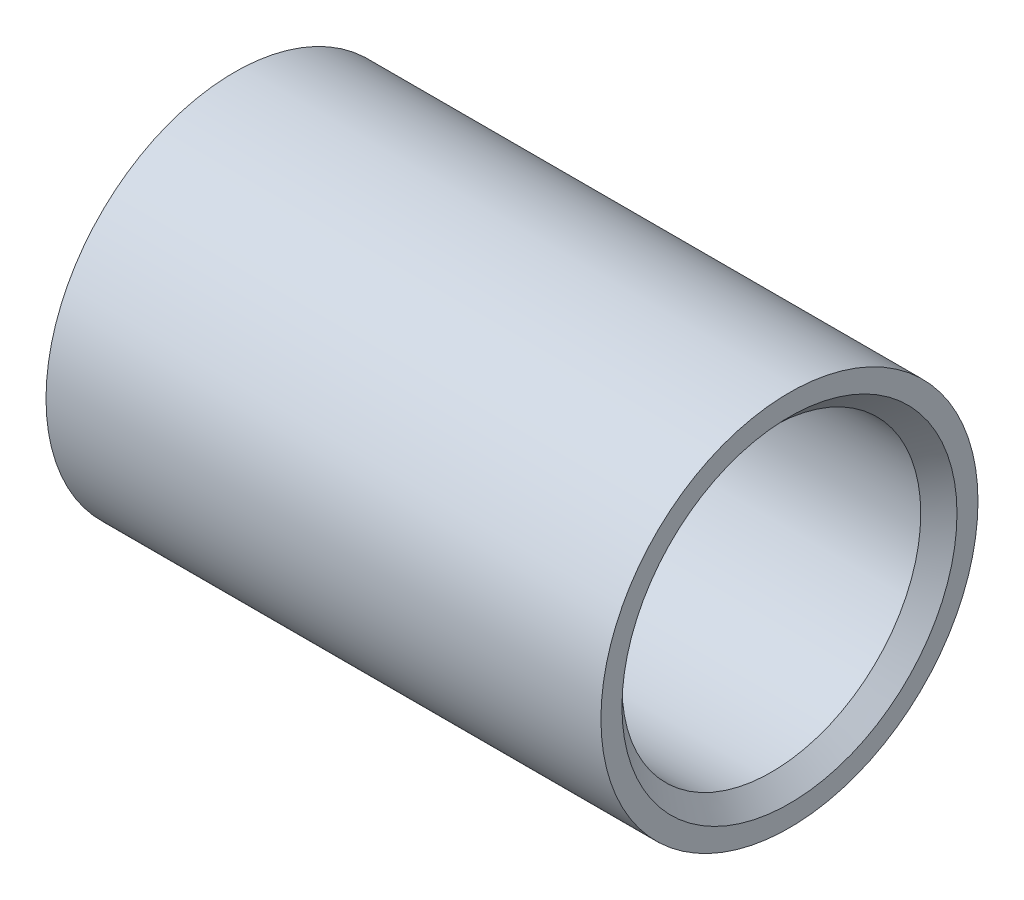
from build123d import *


with BuildPart() as part:
    # Sketch1 → Revolve1 (revolve)
    with BuildSketch(Plane.XY, mode=Mode.PRIVATE) as revolve1_sk:
        Polygon((0, 13.462), (39.624, 13.462), (39.624, 11.962), (38.33, 10.668), (1.294, 10.668), (0, 11.962), align=None)
    revolve(revolve1_sk.sketch.rotate(Axis((0, 0, 0), (1, 0, 0)), 90), axis=Axis((0, 0, 0), (1, 0, 0)))


solid = part.part
